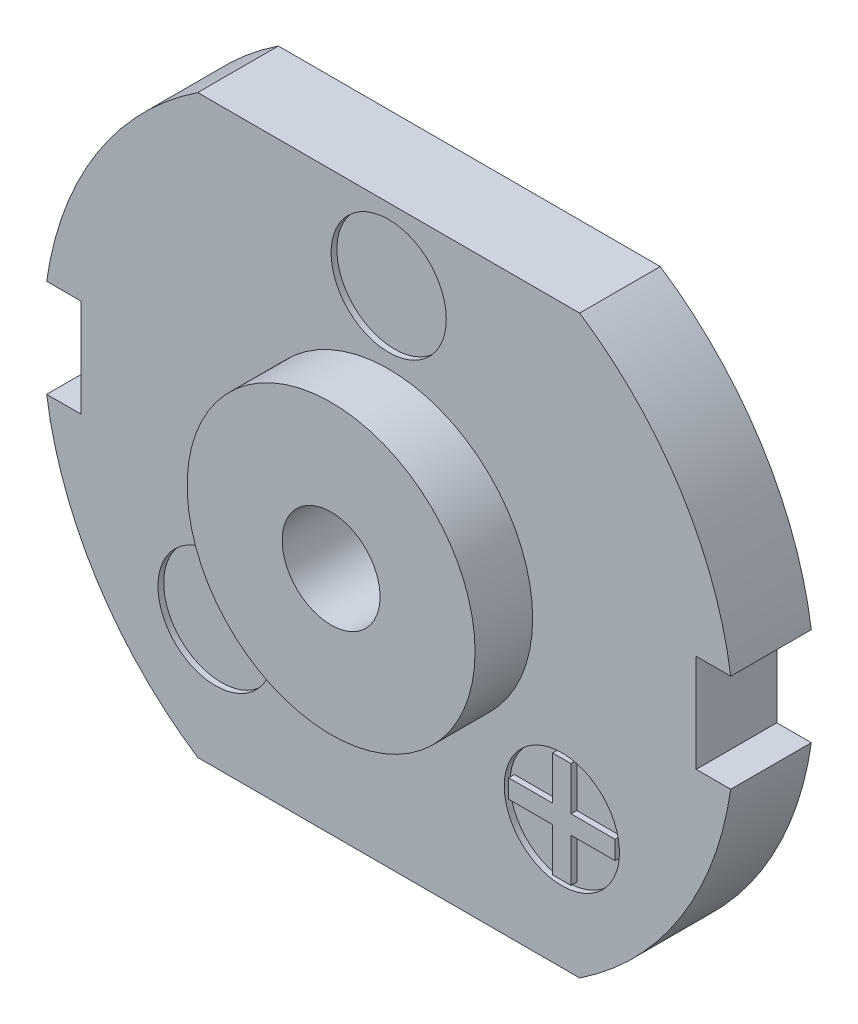
from build123d import *

# Parameters (mm, degrees)
SKETCH1_R           = 0.85
BOSS_EXTRUDE1_DEPTH = 1.4
SKETCH2_R           = 2.5
SKETCH2_R_2         = 0.85
BOSS_EXTRUDE2_DEPTH = 1
SKETCH3_R           = 1
CUT_EXTRUDE1_DEPTH  = 0.1


with BuildPart() as part:
    # Sketch1 → Boss-Extrude1 (new body)
    with BuildSketch(Plane.XY):
        with BuildLine():
            Line((-5.340410415, 0.85), (-5.93948651, 0.85))
            ThreePointArc((-5.93948651, 0.85), (-5.071934946, 3.205538317), (-3.31662479, 5))
            Line((-3.31662479, 5), (3.31662479, 5))
            ThreePointArc((3.31662479, 5), (5.071934946, 3.205538317), (5.93948651, 0.85))
            Line((5.93948651, 0.85), (5.340410415, 0.85))
            Line((5.340410415, 0.85), (5.340410415, -0.85))
            Line((5.340410415, -0.85), (5.93948651, -0.85))
            ThreePointArc((5.93948651, -0.85), (5.071934946, -3.205538317), (3.31662479, -5))
            Line((3.31662479, -5), (-3.31662479, -5))
            ThreePointArc((-3.31662479, -5), (-5.071934946, -3.205538317), (-5.93948651, -0.85))
            Line((-5.93948651, -0.85), (-5.340410415, -0.85))
            Line((-5.340410415, -0.85), (-5.340410415, 0.85))
        make_face()
        Circle(SKETCH1_R, mode=Mode.SUBTRACT)
    extrude(amount=BOSS_EXTRUDE1_DEPTH)

    # Sketch2 → Boss-Extrude2 (add)
    with BuildSketch(Plane.XY.offset(1.4)):
        Circle(SKETCH2_R)
        Circle(SKETCH2_R_2, mode=Mode.SUBTRACT)
    extrude(amount=BOSS_EXTRUDE2_DEPTH)

    # Sketch3 → Cut-Extrude1 (cut)
    # profile 1 of 3: a face of its own
    with BuildSketch(Plane.XY.offset(1.4)):
        with Locations((0, 3.75)):
            Circle(SKETCH3_R)
    # profile 2 of 3: a face of its own
    with BuildSketch(Plane.XY.offset(1.4)):
        with Locations((-3.006653395, -2.766898706)):
            Circle(SKETCH3_R)
    # profile 3 of 3: a face of its own
    with BuildSketch(Plane.XY.offset(1.4)):
        with Locations(Location((3.006653395, -2.766898706, 0), (0, 0, 180))):
            Circle(SKETCH3_R)
        Polygon((3.166281654, -2.605998411), (3.930459475, -2.605998411), (3.930459475, -2.927799001), (3.166281654, -2.927799001), (3.166281654, -3.683401413), (2.847025136, -3.683401413), (2.847025136, -2.927799001), (2.082847315, -2.927799001), (2.082847315, -2.605998411), (2.847025136, -2.605998411), (2.847025136, -1.850395999), (3.166281654, -1.850395999), align=None, mode=Mode.SUBTRACT)
    extrude(amount=-CUT_EXTRUDE1_DEPTH, mode=Mode.SUBTRACT)


solid = part.part
